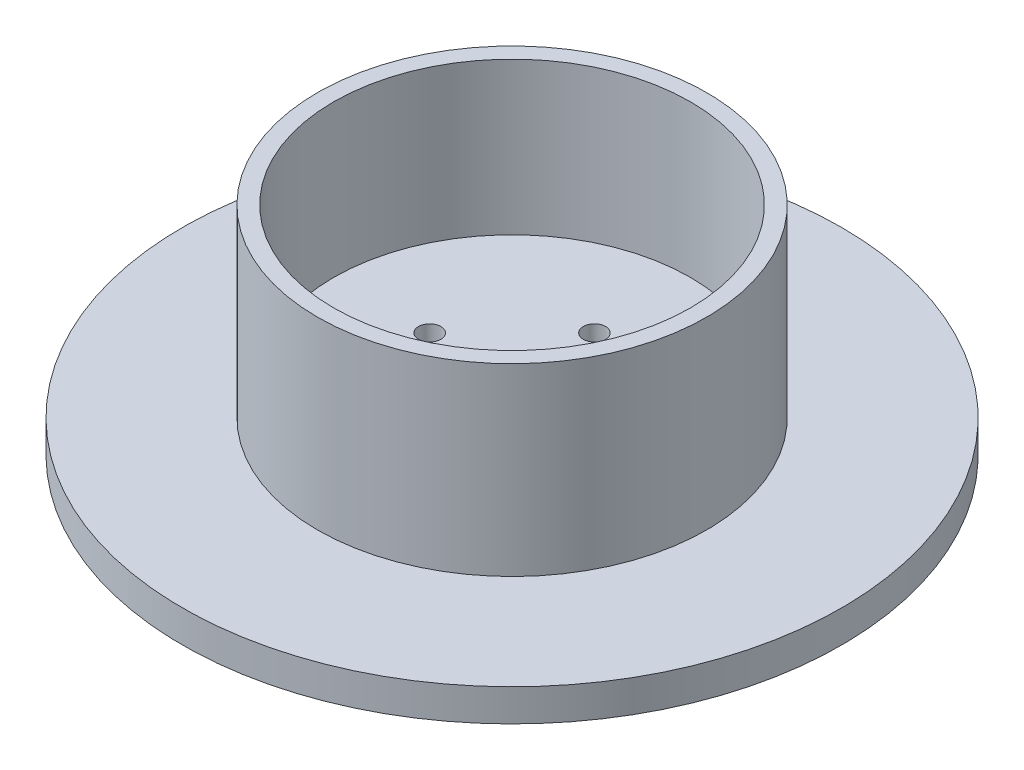
from build123d import *

# Parameters (mm, degrees)
SKETCH1_R           = 19.1875
BOSS_EXTRUDE1_DEPTH = 3.175
SKETCH2_R           = 19.1875
SKETCH2_R_2         = 17.6
BOSS_EXTRUDE2_DEPTH = 15
SKETCH3_R           = 1.1
CUT_EXTRUDE1_DEPTH  = 33.659622434
BOSS_EXTRUDE3_START = 3.175
SKETCH4_R           = 32.5
SKETCH4_R_2         = 1.1
BOSS_EXTRUDE3_DEPTH = 3.175


with BuildPart() as part:
    # Sketch1 → Boss-Extrude1 (new body)
    with BuildSketch(Plane(origin=(0, 0, 0), x_dir=(1, 0, 0), z_dir=(0, 1, 0))):
        with Locations(Location((0, 0, 0), (0, 0, 270))):
            Circle(SKETCH1_R)
    extrude(amount=BOSS_EXTRUDE1_DEPTH)

    # Sketch2 → Boss-Extrude2 (add)
    with BuildSketch(Plane(origin=(0, 3.175, 0), x_dir=(1, 0, 0), z_dir=(0, 1, 0))):
        with Locations(Location((0, 0, 0), (0, 0, 270))):
            Circle(SKETCH2_R)
        with Locations(Location((0, 0, 0), (0, 0, 270))):
            Circle(SKETCH2_R_2, mode=Mode.SUBTRACT)
    extrude(amount=BOSS_EXTRUDE2_DEPTH)

    # Sketch3 → Cut-Extrude1 (cut, through all)
    with BuildSketch(Plane.XZ):
        with Locations(Location((0, 8.125, 0), (0, 0, 270))):
            Circle(SKETCH3_R)
        with Locations(Location((8.125, 0, 0), (0, 0, 270))):
            Circle(SKETCH3_R)
        with Locations(Location((-8.125, 0, 0), (0, 0, 270))):
            Circle(SKETCH3_R)
        with Locations(Location((0, -8.125, 0), (0, 0, 270))):
            Circle(SKETCH3_R)
    extrude(amount=-CUT_EXTRUDE1_DEPTH, mode=Mode.SUBTRACT)

    # Sketch4 → Boss-Extrude3 (add)
    with BuildSketch(Plane.XZ.offset(BOSS_EXTRUDE3_START)):
        with Locations(Location((0, 0, 0), (0, 0, 270))):
            Circle(SKETCH4_R)
        with Locations(Location((0, -8.125, 0), (0, 0, 270))):
            Circle(SKETCH4_R_2, mode=Mode.SUBTRACT)
        with Locations(Location((8.125, 0, 0), (0, 0, 270))):
            Circle(SKETCH4_R_2, mode=Mode.SUBTRACT)
        with Locations(Location((-8.125, 0, 0), (0, 0, 270))):
            Circle(SKETCH4_R_2, mode=Mode.SUBTRACT)
        with Locations(Location((0, 8.125, 0), (0, 0, 270))):
            Circle(SKETCH4_R_2, mode=Mode.SUBTRACT)
    extrude(amount=-BOSS_EXTRUDE3_DEPTH)


solid = part.part
